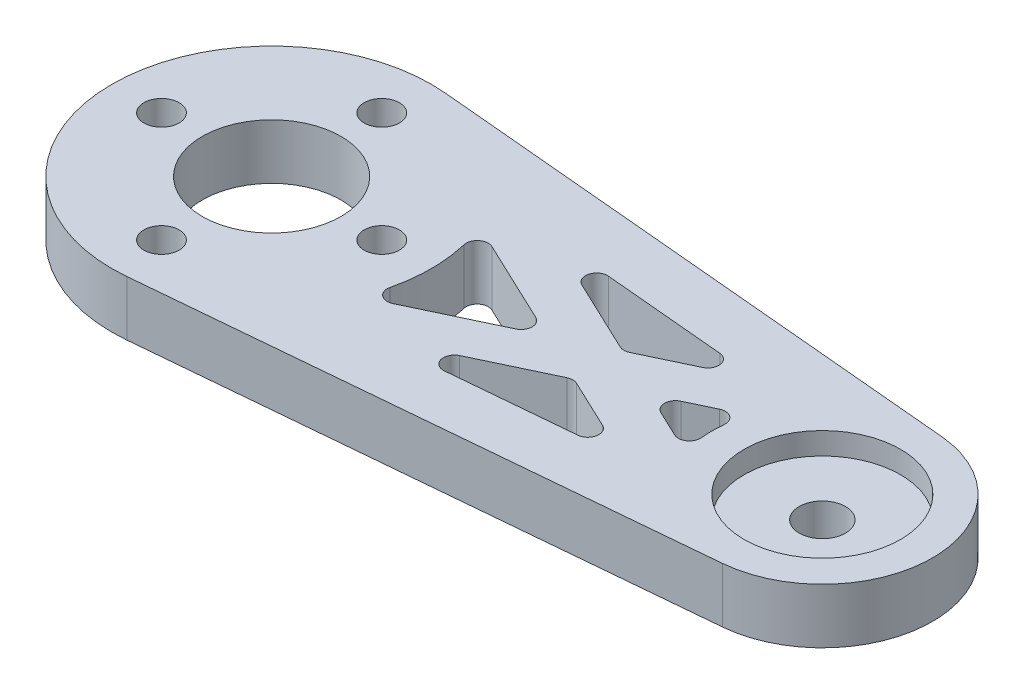
from build123d import *

# Parameters (mm, degrees)
SKETCH_1_R          = 1.6
SKETCH_1_R_2        = 6.3
SKETCH_1_R_3        = 7.1
EXTRUDE_1_DEPTH     = 5
SKETCH_1_3_R        = 7.1
SKETCH_1_3_R_2      = 2.1
EXTRUDE_2_DEPTH     = 3
FILLET_1_R          = 1
FILLET_2_R          = 1
FILLET_3_R          = 1
FILLET_4_R          = 1
SKETCH_2_R          = 3
CUT_EXTRUDE_1_DEPTH = 1


with BuildPart() as part:
    # 草图1 → 凸台-拉伸1 (new body)
    with BuildSketch(Plane(origin=(0, 0, 0), x_dir=(1, 0, 0), z_dir=(0, 1, 0))):
        with BuildLine():
            ThreePointArc((1.305, 14.441155598), (-14.5, 0), (1.305, -14.441155598))
            Line((1.305, -14.441155598), (50.9, -9.959417654))
            ThreePointArc((50.9, -9.959417654), (60, 0), (50.9, 9.959417654))
            Line((50.9, 9.959417654), (1.305, 14.441155598))
        make_face()
        with Locations((0, -10)):
            Circle(SKETCH_1_R, mode=Mode.SUBTRACT)
        with Locations((-10, 0)):
            Circle(SKETCH_1_R, mode=Mode.SUBTRACT)
        Circle(SKETCH_1_R_2, mode=Mode.SUBTRACT)
        with Locations((10, 0)):
            Circle(SKETCH_1_R, mode=Mode.SUBTRACT)
        with BuildLine():
            ThreePointArc((13.42623574, -5.475965106), (14.5, 0), (13.42623574, 5.475965106))
            Line((13.42623574, 5.475965106), (24.990033856, 0))
            Line((24.990033856, 0), (13.42623574, -5.475965106))
        make_face(mode=Mode.SUBTRACT)
        Polygon((37.900667884, -6.113750926), (17.540160593, -7.953663379), (29.663119838, -2.212910976), align=None, mode=Mode.SUBTRACT)
        with Locations((50, 0)):
            Circle(SKETCH_1_R_3, mode=Mode.SUBTRACT)
        with Locations((0, 10)):
            Circle(SKETCH_1_R, mode=Mode.SUBTRACT)
        with BuildLine():
            Line((40.424641065, -2.88314087), (34.33620582, 0))
            Line((34.33620582, 0), (40.424641065, 2.88314087))
            ThreePointArc((40.424641065, 2.88314087), (40, 0), (40.424641065, -2.88314087))
        make_face(mode=Mode.SUBTRACT)
        Polygon((29.663119838, 2.212910976), (17.540160593, 7.953663379), (37.900667884, 6.113750926), align=None, mode=Mode.SUBTRACT)
    extrude(amount=EXTRUDE_1_DEPTH)

    # 草图1<3> → 凸台-拉伸2 (add)
    with BuildSketch(Plane(origin=(0, 0, 0), x_dir=(1, 0, 0), z_dir=(0, 1, 0))):
        with Locations((50, 0)):
            Circle(SKETCH_1_3_R)
        with Locations((50, 0)):
            Circle(SKETCH_1_3_R_2, mode=Mode.SUBTRACT)
    extrude(amount=EXTRUDE_2_DEPTH)

    # 圆角1
    fillet_1_edges = [part.edges().sort_by_distance(p)[0] for p in [
        (34.33620582, 2.5, 0),
        (40.424641065, 2.5, -2.88314087),
        (40.424641065, 2.5, 2.88314087),
    ]]
    fillet(fillet_1_edges, radius=FILLET_1_R)

    # 圆角2
    fillet_2_edges = [part.edges().sort_by_distance(p)[0] for p in [
        (29.663119838, 2.5, 2.212910976),
        (17.540160593, 2.5, 7.953663379),
        (37.900667884, 2.5, 6.113750926),
    ]]
    fillet(fillet_2_edges, radius=FILLET_2_R)

    # 圆角3
    fillet_3_edges = [part.edges().sort_by_distance(p)[0] for p in [
        (17.540160593, 2.5, -7.953663379),
        (29.663119838, 2.5, -2.212910976),
        (37.900667884, 2.5, -6.113750926),
    ]]
    fillet(fillet_3_edges, radius=FILLET_3_R)

    # 圆角4
    fillet_4_edges = [part.edges().sort_by_distance(p)[0] for p in [
        (13.42623574, 2.5, -5.475965106),
        (24.990033856, 2.5, 0),
        (13.42623574, 2.5, 5.475965106),
    ]]
    fillet(fillet_4_edges, radius=FILLET_4_R)

    # 草图2 → 切除-拉伸1 (cut)
    with BuildSketch(Plane(origin=(0, 0, 0), x_dir=(1, 0, 0), z_dir=(0, 1, 0))):
        with Locations((0, -10)):
            Circle(SKETCH_2_R)
        with Locations((-10, 0)):
            Circle(SKETCH_2_R)
        with Locations((0, 10)):
            Circle(SKETCH_2_R)
        with Locations((10, 0)):
            Circle(SKETCH_2_R)
    extrude(amount=CUT_EXTRUDE_1_DEPTH, mode=Mode.SUBTRACT)


solid = part.part
